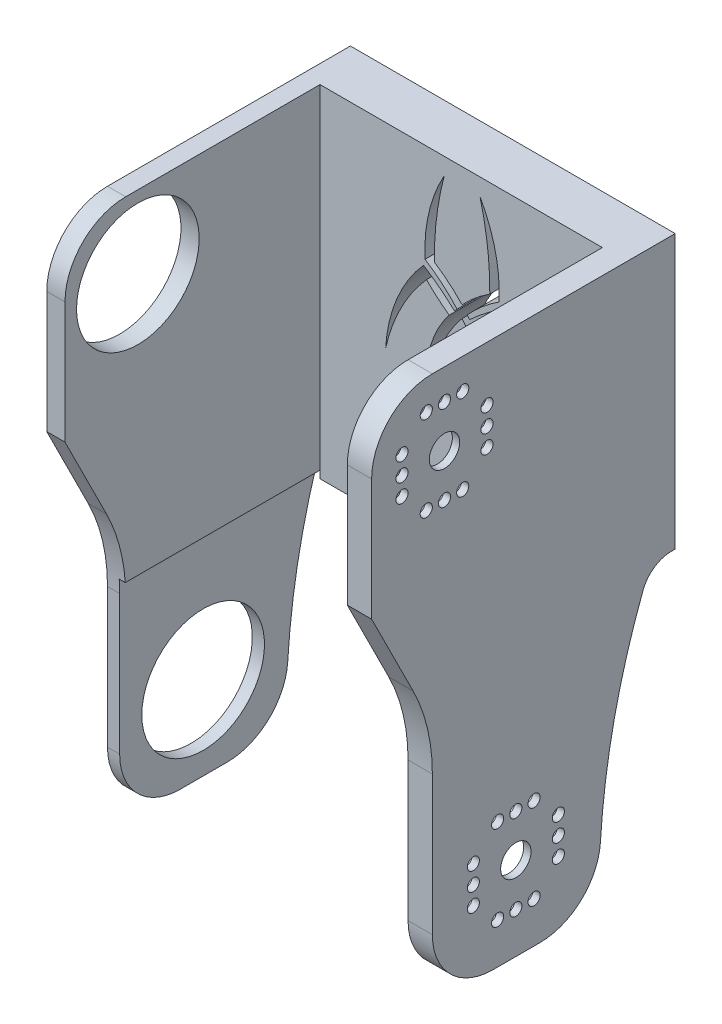
from build123d import *

# Parameters (mm, degrees)
BOSS_EXTRUDE1_DEPTH = 90
SKETCH2_R           = 10.1
CUT_EXTRUDE1_DEPTH  = 2.8
SKETCH3_R           = 2.5
SKETCH3_R_2         = 1
CUT_EXTRUDE2_DEPTH  = 22
SKETCH4_R           = 10.1
CUT_EXTRUDE3_DEPTH  = 10
FILLET1_R           = 10
CUT_EXTRUDE9_DEPTH  = 70
FILLET2_R           = 30
SKETCH9_R           = 2.5
SKETCH9_R_2         = 1
CUT_EXTRUDE11_DEPTH = 22.8
SKETCH10_R          = 10.1
CUT_EXTRUDE12_DEPTH = 2.8
SKETCH11_R          = 10.1
CUT_EXTRUDE13_DEPTH = 12.8
FILLET4_R           = 10
SKETCH13_W          = 1
SKETCH13_H          = 35
CUT_EXTRUDE14_DEPTH = 50
CUT_EXTRUDE20_DEPTH = 20


with BuildPart() as part:
    # Sketch1 → Boss-Extrude1 (new body)
    with BuildSketch(Plane(origin=(0, 0, 0), x_dir=(1, 0, 0), z_dir=(0, 1, 0))):
        Polygon((-27.5, 0), (-27.5, 42), (19, 42), (19, 0), (23, 0), (23, 50), (-30.5, 50), (-30.5, 0), align=None)
    extrude(amount=BOSS_EXTRUDE1_DEPTH)

    # Sketch2 → Cut-Extrude1 (cut)
    with BuildSketch(Plane.ZY.offset(-19)):
        with Locations((-12, 78)):
            Circle(SKETCH2_R)
    extrude(amount=-CUT_EXTRUDE1_DEPTH, mode=Mode.SUBTRACT)

    # Sketch3 → Cut-Extrude2 (cut)
    with BuildSketch(Plane.ZY.offset(-21.8)):
        with Locations((-12, 78)):
            Circle(SKETCH3_R)
        with Locations((-15, 85)):
            Circle(SKETCH3_R_2)
        with Locations((-12, 85)):
            Circle(SKETCH3_R_2)
        with Locations((-9, 85)):
            Circle(SKETCH3_R_2)
        with Locations((-19, 81)):
            Circle(SKETCH3_R_2)
        with Locations((-19, 78)):
            Circle(SKETCH3_R_2)
        with Locations((-19, 75)):
            Circle(SKETCH3_R_2)
        with Locations((-15, 71)):
            Circle(SKETCH3_R_2)
        with Locations((-12, 71)):
            Circle(SKETCH3_R_2)
        with Locations((-9, 71)):
            Circle(SKETCH3_R_2)
        with Locations((-5, 75)):
            Circle(SKETCH3_R_2)
        with Locations((-5, 78)):
            Circle(SKETCH3_R_2)
        with Locations((-5, 81)):
            Circle(SKETCH3_R_2)
    extrude(amount=-CUT_EXTRUDE2_DEPTH, mode=Mode.SUBTRACT)

    # Sketch4 → Cut-Extrude3 (cut)
    with BuildSketch(Plane.ZY.offset(30.5)):
        with Locations((-12, 78)):
            Circle(SKETCH4_R)
    extrude(amount=-CUT_EXTRUDE3_DEPTH, mode=Mode.SUBTRACT)

    # Fillet1
    fillet1_edges = [part.edges().sort_by_distance(p)[0] for p in [
        (21, 90, 0),
        (-29, 90, 0),
    ]]
    fillet(fillet1_edges, radius=FILLET1_R)

    # Sketch8 → Cut-Extrude9 (cut)
    with BuildSketch(Plane(origin=(23, 0, 0), x_dir=(0, 0, -1), z_dir=(1, 0, 0))):
        Polygon((0, 0), (10, 0), (10, 40), (0, 60), align=None)
        with BuildLine():
            Line((50, 45), (49.384007447, 45))
            ThreePointArc((49.384007447, 45), (46.548633561, 44.118331571), (44.713203531, 41.784261971))
            ThreePointArc((44.713203531, 41.784261971), (39.074197476, 21.242984276), (37.5, 0))
            Line((37.5, 0), (50, 0))
            Line((50, 0), (50, 45))
        make_face()
    extrude(amount=-CUT_EXTRUDE9_DEPTH, mode=Mode.SUBTRACT)

    # Fillet2
    fillet2_edges = [part.edges().sort_by_distance(p)[0] for p in [
        (-29, 40, -10),
        (21, 40, -10),
    ]]
    fillet(fillet2_edges, radius=FILLET2_R)

    # Sketch9 → Cut-Extrude11 (cut)
    with BuildSketch(Plane.ZY.offset(-19)):
        with Locations((-23.75, 13.75)):
            Circle(SKETCH9_R)
        with Locations((-23.75, 20.75)):
            Circle(SKETCH9_R_2)
        with Locations((-26.75, 20.75)):
            Circle(SKETCH9_R_2)
        with Locations((-20.75, 20.75)):
            Circle(SKETCH9_R_2)
        with Locations((-16.75, 10.75)):
            Circle(SKETCH9_R_2)
        with Locations((-16.75, 13.75)):
            Circle(SKETCH9_R_2)
        with Locations((-16.75, 16.75)):
            Circle(SKETCH9_R_2)
        with Locations((-26.75, 6.75)):
            Circle(SKETCH9_R_2)
        with Locations((-23.75, 6.75)):
            Circle(SKETCH9_R_2)
        with Locations((-20.75, 6.75)):
            Circle(SKETCH9_R_2)
        with Locations((-30.75, 16.75)):
            Circle(SKETCH9_R_2)
        with Locations((-30.75, 13.75)):
            Circle(SKETCH9_R_2)
        with Locations((-30.75, 10.75)):
            Circle(SKETCH9_R_2)
    extrude(amount=-CUT_EXTRUDE11_DEPTH, mode=Mode.SUBTRACT)

    # Sketch10 → Cut-Extrude12 (cut)
    with BuildSketch(Plane.ZY.offset(-19)):
        with Locations((-23.75, 13.75)):
            Circle(SKETCH10_R)
    extrude(amount=-CUT_EXTRUDE12_DEPTH, mode=Mode.SUBTRACT)

    # Sketch11 → Cut-Extrude13 (cut)
    with BuildSketch(Plane.ZY.offset(30.5)):
        with Locations((-23.75, 13.75)):
            Circle(SKETCH11_R)
    extrude(amount=-CUT_EXTRUDE13_DEPTH, mode=Mode.SUBTRACT)

    # Fillet4
    fillet4_edges = [part.edges().sort_by_distance(p)[0] for p in [
        (-29, 0, -10),
        (21, 0, -10),
        (21, 0, -37.5),
        (-29, 0, -37.5),
    ]]
    fillet(fillet4_edges, radius=FILLET4_R)

    # Sketch13 → Cut-Extrude14 (cut)
    with BuildSketch(Plane.XY):
        with Locations((-28, 17.5)):
            Rectangle(SKETCH13_W, SKETCH13_H)
    extrude(amount=-CUT_EXTRUDE14_DEPTH, mode=Mode.SUBTRACT)

    # Sketch14 → Cut-Extrude20 (cut)
    with BuildSketch(Plane(origin=(0, 0, -50), x_dir=(-1, 0, 0), z_dir=(0, 0, -1))):
        with BuildLine():
            Line((3.27778227, 69.250932504), (2.845176463, 68.801688012))
            ThreePointArc((2.845176463, 68.801688012), (0.391852409, 70.892666632), (-2.246261107, 72.745056327))
            ThreePointArc((-2.246261107, 72.745056327), (-6.625047437, 65.79780173), (-8.487956293, 57.799821563))
            ThreePointArc((-8.487956293, 57.799821563), (-5.961417112, 64.793099841), (-1.768021606, 70.933521279))
            ThreePointArc((-1.768021606, 70.933521279), (0.045073944, 69.272193574), (1.971595392, 67.743847957))
            ThreePointArc((1.971595392, 67.743847957), (-1.648113464, 59.360569649), (-0.654011446, 50.283488148))
            ThreePointArc((-0.654011446, 50.283488148), (-0.301953995, 59.840560068), (4.104319798, 68.328570399))
            ThreePointArc((4.104319798, 68.328570399), (8.510593592, 59.840560068), (8.862651043, 50.283488148))
            ThreePointArc((8.862651043, 50.283488148), (9.856753061, 59.360569649), (6.237044205, 67.743847957))
            ThreePointArc((6.237044205, 67.743847957), (8.163565653, 69.272193574), (9.976661203, 70.933521279))
            ThreePointArc((9.976661203, 70.933521279), (14.170056709, 64.793099841), (16.69659589, 57.799821563))
            ThreePointArc((16.69659589, 57.799821563), (14.833687034, 65.79780173), (10.454900704, 72.745056327))
            ThreePointArc((10.454900704, 72.745056327), (7.816787188, 70.892666632), (5.363463133, 68.801688012))
            Line((5.363463133, 68.801688012), (4.930857327, 69.250932504))
            ThreePointArc((4.930857327, 69.250932504), (7.415465307, 71.667758801), (10.199165492, 73.733028626))
            ThreePointArc((10.199165492, 73.733028626), (9.57768596, 80.703606058), (7.041999649, 87.2262958))
            ThreePointArc((7.041999649, 87.2262958), (8.295873303, 80.714857968), (8.669787468, 74.094343639))
            ThreePointArc((8.669787468, 74.094343639), (6.272067499, 72.3318465), (4.104319798, 70.29313928))
            ThreePointArc((4.104319798, 70.29313928), (1.936572098, 72.3318465), (-0.461147871, 74.094343639))
            ThreePointArc((-0.461147871, 74.094343639), (-0.087233707, 80.714857968), (1.166639948, 87.2262958))
            ThreePointArc((1.166639948, 87.2262958), (-1.369046364, 80.703606058), (-1.990525895, 73.733028626))
            ThreePointArc((-1.990525895, 73.733028626), (0.79317429, 71.667758801), (3.27778227, 69.250932504))
        make_face()
    extrude(amount=-CUT_EXTRUDE20_DEPTH, mode=Mode.SUBTRACT)


solid = part.part
